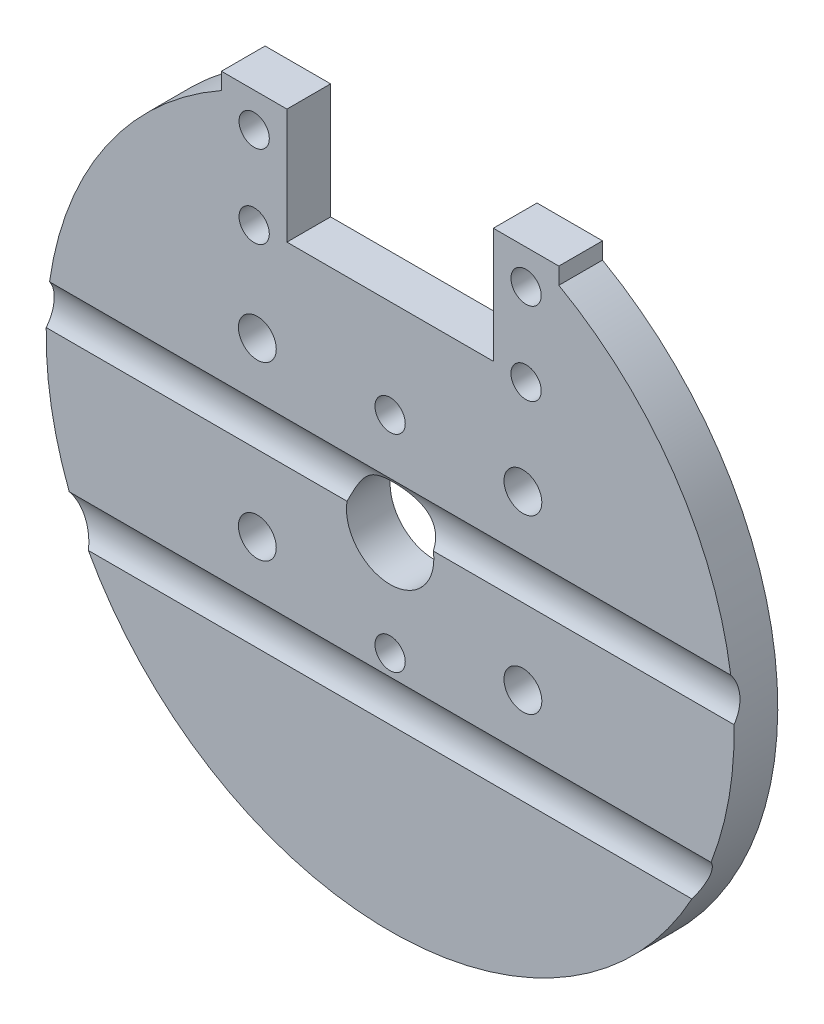
from build123d import *

# Parameters (mm, degrees)
SKETCH1_R               = 50
EXTRUDE_1_4_DEPTH       = 6.35
CUT_EXTRUDE1_DEPTH      = 6.35
SKETCH3_W               = 9.525
SKETCH3_H               = 16.75
BOSS_EXTRUDE2_DEPTH     = 6.35
SKETCH4_R               = 2.2
M4_THROUGH_DEPTH        = 6.35
SKETCH5_R               = 6.35
CUT_EXTRUDE2_DEPTH      = 6.35
SKETCH6_R               = 2.2
M4_THROUGH2_DEPTH       = 6.35
SKETCH7_R               = 2.75
M5_THROUGH_DEPTH        = 6.35
CHAMFER1_SIZE           = 2.5
CUT_EXTRUDE4_DEPTH      = 71.995228713
CUT_EXTRUDE4_DEPTH_BACK = 71.995228713
SKETCH8_R               = 5


with BuildPart() as part:
    # Sketch1 → 1/4 (new body)
    with BuildSketch(Plane.XY):
        Circle(SKETCH1_R)
    extrude(amount=EXTRUDE_1_4_DEPTH)

    # Sketch2 → Cut-Extrude1 (cut)
    with BuildSketch(Plane.XY.offset(6.35)):
        Polygon((-15, 46), (-15, 29.25), (15, 29.25), (15, 46), (28.100203936, 46), (28.100203936, 76.142415264), (-30.736146894, 76.142415264), (-30.736146894, 46), align=None)
    extrude(amount=-CUT_EXTRUDE1_DEPTH, mode=Mode.SUBTRACT)

    # Sketch3 → Boss-Extrude2 (add)
    with BuildSketch(Plane.XY.offset(6.35)):
        with Locations((-19.7625, 37.625)):
            Rectangle(SKETCH3_W, SKETCH3_H)
        with Locations((19.7625, 37.625)):
            Rectangle(SKETCH3_W, SKETCH3_H)
    extrude(amount=-BOSS_EXTRUDE2_DEPTH)

    # Sketch4 → M4_through (cut)
    with BuildSketch(Plane.XY.offset(6.35)):
        with Locations((-19.7625, 41)):
            Circle(SKETCH4_R)
        with Locations((-19.7625, 29)):
            Circle(SKETCH4_R)
        with Locations((19.7625, 29)):
            Circle(SKETCH4_R)
        with Locations((19.7625, 41)):
            Circle(SKETCH4_R)
    extrude(amount=-M4_THROUGH_DEPTH, mode=Mode.SUBTRACT)

    # Sketch5 → Cut-Extrude2 (cut)
    with BuildSketch(Plane.XY.offset(6.35)):
        Circle(SKETCH5_R)
    extrude(amount=-CUT_EXTRUDE2_DEPTH, mode=Mode.SUBTRACT)

    # Sketch6 → M4_through2 (cut)
    with BuildSketch(Plane.XY.offset(6.35)):
        with Locations((0, 15)):
            Circle(SKETCH6_R)
        with Locations((0, -15)):
            Circle(SKETCH6_R)
    extrude(amount=-M4_THROUGH2_DEPTH, mode=Mode.SUBTRACT)

    # Sketch7 → M5_through (cut)
    with BuildSketch(Plane.XY.offset(6.35)):
        with Locations((-19.3, 15)):
            Circle(SKETCH7_R)
        with Locations((-19.3, -10)):
            Circle(SKETCH7_R)
        with Locations((19.3, -10)):
            Circle(SKETCH7_R)
        with Locations((19.3, 15)):
            Circle(SKETCH7_R)
    extrude(amount=-M5_THROUGH_DEPTH, mode=Mode.SUBTRACT)

    # Chamfer1
    chamfer1_edges = [part.edges().sort_by_distance(p)[0] for p in [
        (17.5625, 41, 0),
        (17.5625, 29, 0),
        (-21.9625, 29, 0),
        (-21.9625, 41, 0),
    ]]
    chamfer(chamfer1_edges, length=CHAMFER1_SIZE)

    # Sketch8 → Cut-Extrude4 (cut, two sides: drawn at the far end of the back side and taken through both)
    with BuildSketch(Plane(origin=(0, 0, 0), x_dir=(0, 0, -1), z_dir=(1, 0, 0)).offset(-CUT_EXTRUDE4_DEPTH_BACK)):
        with Locations((-10.35, 4)):
            Circle(SKETCH8_R)
        with Locations((-10.35, -21)):
            Circle(SKETCH8_R)
    extrude(amount=CUT_EXTRUDE4_DEPTH + CUT_EXTRUDE4_DEPTH_BACK, mode=Mode.SUBTRACT)


solid = part.part
